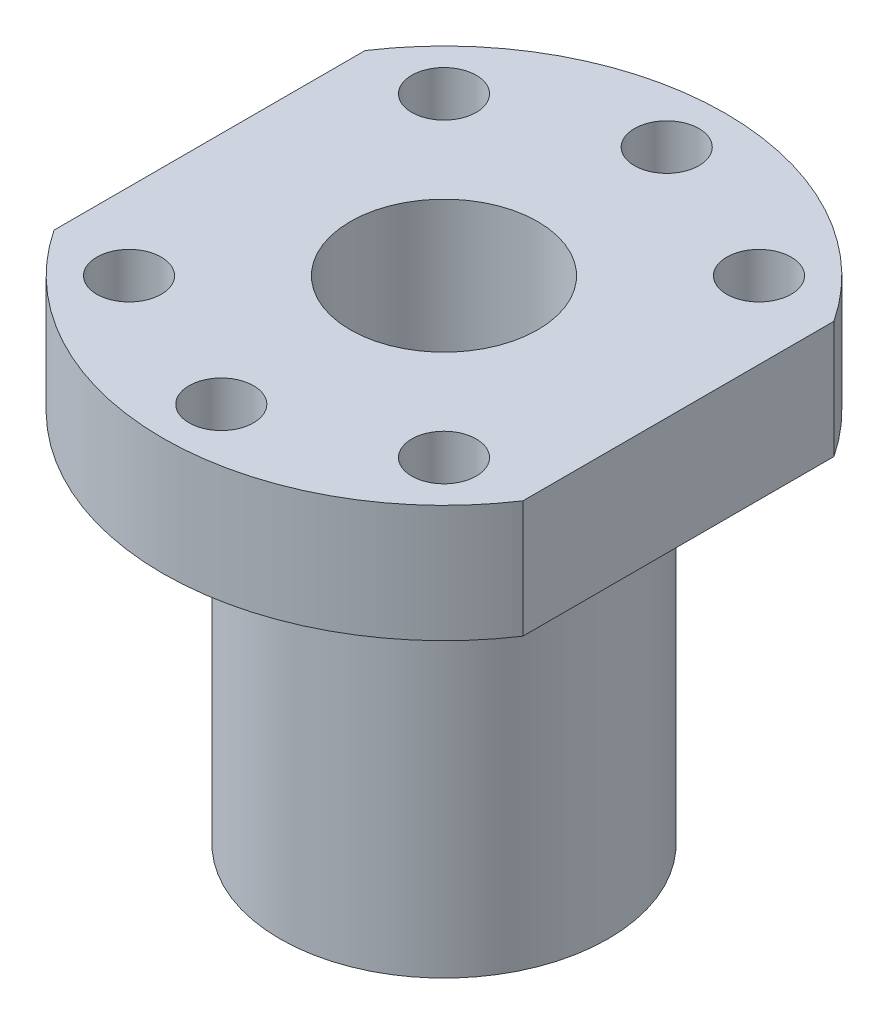
from build123d import *

# Parameters (mm, degrees)
CUT_EXTRUDE1_DEPTH      = 55
CUT_EXTRUDE1_DEPTH_BACK = 55
CUT_EXTRUDE2_DEPTH      = 53.345009313
CUT_EXTRUDE2_DEPTH_BACK = 53.345009313
SKETCH3_R               = 2.75
SKETCH4_R               = 8
CUT_EXTRUDE3_DEPTH      = 53.345009313


with BuildPart() as part:
    # Sketch1 → Revolve1 (revolve)
    with BuildSketch(Plane.XY, mode=Mode.PRIVATE) as revolve1_sk:
        Polygon((0, 0), (14, 0), (14, 32), (24, 32), (24, 42), (0, 42), align=None)
    revolve(revolve1_sk.sketch.rotate(Axis((0, 0, 0), (0, 1, 0)), 90), axis=Axis((0, 0, 0), (0, 1, 0)))

    # Sketch2 → Cut-Extrude1 (cut, two sides: drawn at the far end of the back side and taken through both)
    with BuildSketch(Plane(origin=(0, 42, 0), x_dir=(1, 0, 0), z_dir=(0, 1, 0)).offset(-CUT_EXTRUDE1_DEPTH_BACK)):
        with BuildLine():
            Line((-20, 13.266499161), (-20, -13.266499161))
            ThreePointArc((-20, -13.266499161), (-24, 0), (-20, 13.266499161))
        make_face()
        with BuildLine():
            Line((20, 13.266499161), (20, -13.266499161))
            ThreePointArc((20, -13.266499161), (24, 0), (20, 13.266499161))
        make_face()
    extrude(amount=CUT_EXTRUDE1_DEPTH + CUT_EXTRUDE1_DEPTH_BACK, mode=Mode.SUBTRACT)

    # Sketch3 → Cut-Extrude2 (cut, two sides: drawn at the far end of the back side and taken through both)
    with BuildSketch(Plane(origin=(0, 42, 0), x_dir=(1, 0, 0), z_dir=(0, 1, 0)).offset(-CUT_EXTRUDE2_DEPTH_BACK)):
        with Locations(Location((0, 19, 0), (0, 0, 270))):
            Circle(SKETCH3_R)
        with Locations(Location((0, -19, 0), (0, 0, 270))):
            Circle(SKETCH3_R)
        with Locations(Location((-13.435028843, 13.435028843, 0), (0, 0, 270))):
            Circle(SKETCH3_R)
        with Locations(Location((13.435028843, 13.435028843, 0), (0, 0, 270))):
            Circle(SKETCH3_R)
        with Locations(Location((13.435028843, -13.435028843, 0), (0, 0, 270))):
            Circle(SKETCH3_R)
        with Locations(Location((-13.435028843, -13.435028843, 0), (0, 0, 270))):
            Circle(SKETCH3_R)
    extrude(amount=CUT_EXTRUDE2_DEPTH + CUT_EXTRUDE2_DEPTH_BACK, mode=Mode.SUBTRACT)

    # Sketch4 → Cut-Extrude3 (cut, through all)
    with BuildSketch(Plane(origin=(0, 42, 0), x_dir=(1, 0, 0), z_dir=(0, 1, 0))):
        with Locations(Location((0, 0, 0), (0, 0, 270))):
            Circle(SKETCH4_R)
    extrude(amount=-CUT_EXTRUDE3_DEPTH, mode=Mode.SUBTRACT)


solid = part.part
